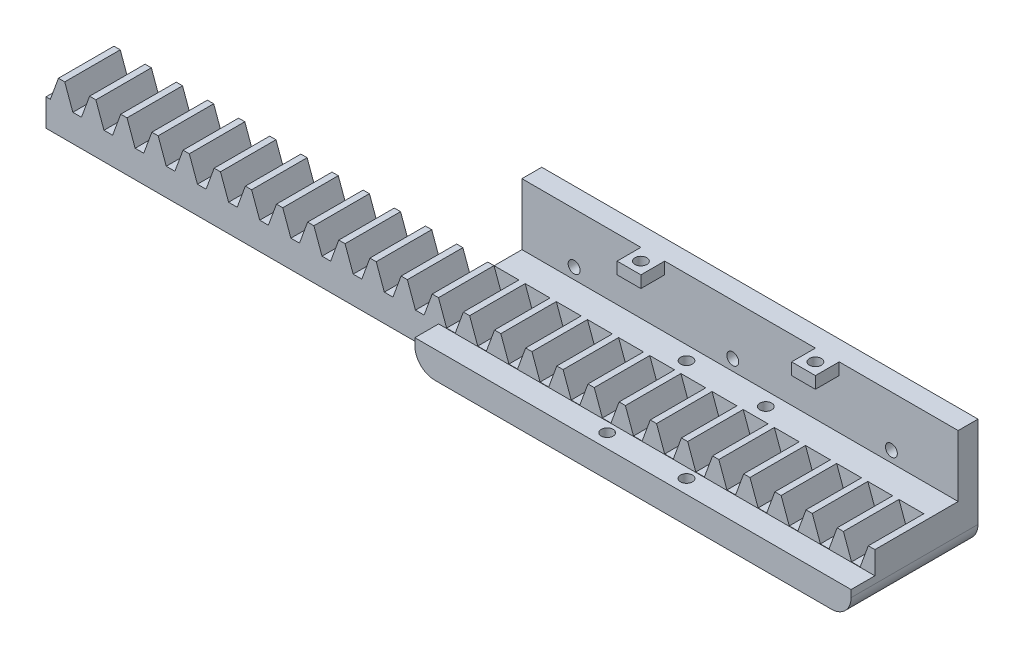
from build123d import *

# Parameters (mm, degrees)
BLANKSKE_W          = 209
BLANKSKE_H          = 12.5
BLANK_DEPTH         = 14
TOOTHCUTSIM_DEPTH   = 210.841011244
TEETHCUTS_COUNT     = 27
TEETHCUTS_PITCH     = 7.853981625
SKETCH2_W           = 110
SKETCH2_H           = 6.78
BOSS_EXTRUDE2_DEPTH = 7
SKETCH3_W           = 110
SKETCH3_H           = 56
BOSS_EXTRUDE3_DEPTH = 5
SKETCH4_W           = 110
SKETCH4_H           = 6.78
BOSS_EXTRUDE4_DEPTH = 7
SKETCH7_W           = 110
SKETCH7_H           = 6.78
BOSS_EXTRUDE5_DEPTH = 6
SKETCH8_W           = 110
SKETCH8_H           = 6.78
BOSS_EXTRUDE6_DEPTH = 20
SKETCH9_W           = 110
SKETCH9_H           = 7
BOSS_EXTRUDE7_DEPTH = 5.72
SKETCH5_R           = 1.5
CUT_EXTRUDE1_DEPTH  = 218.928887484
SKETCH6_R           = 1.5
CUT_EXTRUDE2_DEPTH  = 219.050452877
FILLET1_R           = 5
SKETCH12_W          = 119.263366365
SKETCH12_H          = 39.167998327
CUT_EXTRUDE3_DEPTH  = 28
SKETCH13_W          = 6
SKETCH13_H          = 3
BOSS_EXTRUDE8_DEPTH = 6
SKETCH14_R          = 1.5
CUT_EXTRUDE4_DEPTH  = 6


with BuildPart() as part:
    # BlankSke → Blank (new body)
    with BuildSketch(Plane.XY):
        with Locations((104.5, 6.25)):
            Rectangle(BLANKSKE_W, BLANKSKE_H)
    extrude(amount=-BLANK_DEPTH)

    # TooCutSkeSim → ToothCutSim (cut, through all)
    with BuildSketch(Plane.XY):
        Polygon((1.087088424, 6.875), (-1.087088424, 6.875), (-3.143665836, 12.5254), (3.143665836, 12.5254), align=None)
    toothcutsim = extrude(amount=-TOOTHCUTSIM_DEPTH, mode=Mode.SUBTRACT)

    # TeethCuts: ToothCutSim ×27
    with Locations(*[(i * TEETHCUTS_PITCH, 0, 0) for i in range(1, TEETHCUTS_COUNT)]):
        add(toothcutsim, mode=Mode.SUBTRACT)

    # Sketch2 → Boss-Extrude2 (add)
    with BuildSketch(Plane(origin=(0, 0, -14), x_dir=(-1, 0, 0), z_dir=(0, 0, -1))):
        with Locations((-154, 3.39)):
            Rectangle(SKETCH2_W, SKETCH2_H)
    extrude(amount=BOSS_EXTRUDE2_DEPTH)

    # Sketch3 → Boss-Extrude3 (add)
    with BuildSketch(Plane(origin=(0, 0, -21), x_dir=(-1, 0, 0), z_dir=(0, 0, -1))):
        with Locations((-154, 28)):
            Rectangle(SKETCH3_W, SKETCH3_H)
    extrude(amount=BOSS_EXTRUDE3_DEPTH)

    # Sketch4 → Boss-Extrude4 (add)
    with BuildSketch(Plane.XY.offset(-21)):
        with Locations((154, 52.61)):
            Rectangle(SKETCH4_W, SKETCH4_H)
    extrude(amount=BOSS_EXTRUDE4_DEPTH)

    # Sketch7 → Boss-Extrude5 (add)
    with BuildSketch(Plane.XY):
        with Locations((154, 3.39)):
            Rectangle(SKETCH7_W, SKETCH7_H)
    extrude(amount=BOSS_EXTRUDE5_DEPTH)

    # Sketch8 → Boss-Extrude6 (add)
    with BuildSketch(Plane.XY.offset(-14)):
        with Locations((154, 52.61)):
            Rectangle(SKETCH8_W, SKETCH8_H)
    extrude(amount=BOSS_EXTRUDE6_DEPTH)

    # Sketch9 → Boss-Extrude7 (add)
    with BuildSketch(Plane(origin=(0, 6.78, 0), x_dir=(1, 0, 0), z_dir=(0, 1, 0))):
        with Locations((154, 17.5)):
            Rectangle(SKETCH9_W, SKETCH9_H)
    extrude(amount=BOSS_EXTRUDE7_DEPTH)

    # Sketch5 → Cut-Extrude1 (cut, through all)
    with BuildSketch(Plane.XZ):
        with Locations(Location((164, -17.5, 0), (0, 0, 270))):
            Circle(SKETCH5_R)
        with Locations(Location((144, -17.5, 0), (0, 0, 270))):
            Circle(SKETCH5_R)
        with Locations(Location((144, 2.5, 0), (0, 0, 270))):
            Circle(SKETCH5_R)
        with Locations(Location((164, 2.5, 0), (0, 0, 270))):
            Circle(SKETCH5_R)
    extrude(amount=-CUT_EXTRUDE1_DEPTH, mode=Mode.SUBTRACT)

    # Sketch6 → Cut-Extrude2 (cut, through all)
    with BuildSketch(Plane.XY.offset(-21)):
        with Locations((112.16, 15.28)):
            Circle(SKETCH6_R)
        with Locations((152.16, 15.28)):
            Circle(SKETCH6_R)
        with Locations((192.16, 15.28)):
            Circle(SKETCH6_R)
        with Locations((112.16, 45.28)):
            Circle(SKETCH6_R)
        with Locations((192.16, 45.28)):
            Circle(SKETCH6_R)
        with Locations((152.16, 45.28)):
            Circle(SKETCH6_R)
    extrude(amount=-CUT_EXTRUDE2_DEPTH, mode=Mode.SUBTRACT)

    # Fillet1
    fillet1_edges = [part.edges().sort_by_distance(p)[0] for p in [
        (99, 0, -20),
        (209, 56, -10),
        (99, 56, -10),
        (99, 0, 3),
        (209, 0, -10),
    ]]
    fillet(fillet1_edges, radius=FILLET1_R)

    # Sketch12 → Cut-Extrude3 (cut)
    with BuildSketch(Plane(origin=(0, 56, 0), x_dir=(1, 0, 0), z_dir=(0, 1, 0))):
        with Locations((155.252120093, 7.537257659)):
            Rectangle(SKETCH12_W, SKETCH12_H)
    extrude(amount=-CUT_EXTRUDE3_DEPTH, mode=Mode.SUBTRACT)

    # Sketch13 → Boss-Extrude8 (add)
    with BuildSketch(Plane.XY.offset(-21)):
        with Locations((176, 26.5)):
            Rectangle(SKETCH13_W, SKETCH13_H)
        with Locations((132, 26.5)):
            Rectangle(SKETCH13_W, SKETCH13_H)
    extrude(amount=BOSS_EXTRUDE8_DEPTH)

    # Sketch14 → Cut-Extrude4 (cut)
    with BuildSketch(Plane(origin=(0, 28, 0), x_dir=(-1, 0, 0), z_dir=(0, 1, 0))):
        with Locations(Location((-132, -18, 0), (0, 0, 90))):
            Circle(SKETCH14_R)
        with Locations(Location((-176, -18, 0), (0, 0, 90))):
            Circle(SKETCH14_R)
    extrude(amount=-CUT_EXTRUDE4_DEPTH, mode=Mode.SUBTRACT)


solid = part.part
